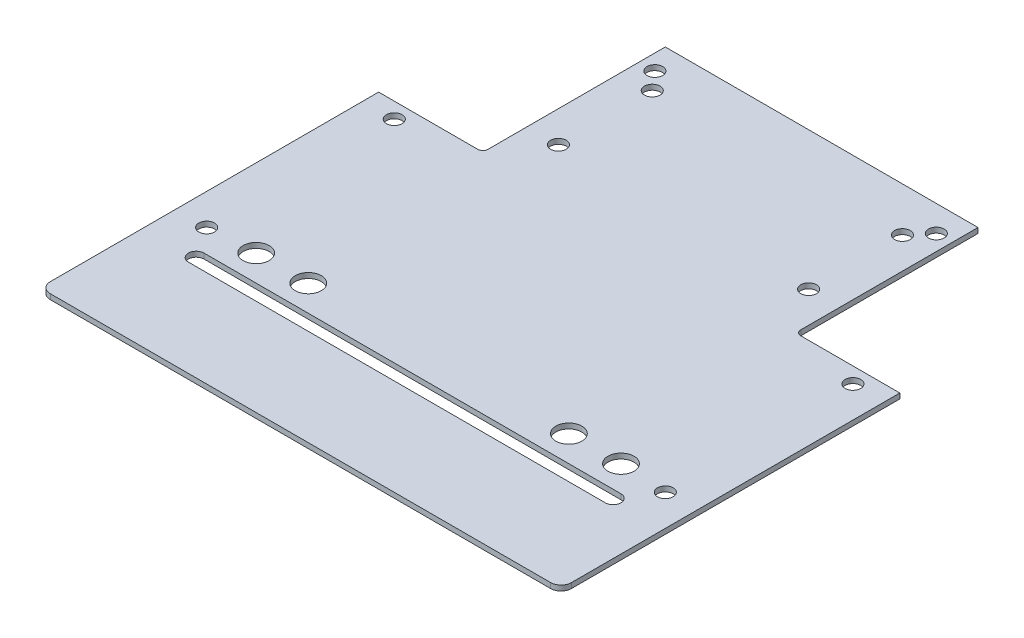
from build123d import *

# Parameters (mm, degrees)
BOSS_EXTRUDE1_DEPTH = 1
SKETCH2_R           = 1.5
SKETCH2_R_2         = 2.5
CUT_EXTRUDE2_DEPTH  = 1
SKETCH3_R           = 1.5
CUT_EXTRUDE3_DEPTH  = 1


with BuildPart() as part:
    # Sketch1 → Boss-Extrude1 (new body)
    with BuildSketch(Plane(origin=(0, 0, 0), x_dir=(1, 0, 0), z_dir=(0, 1, 0))):
        with BuildLine():
            Line((2, 0), (98, 0))
            ThreePointArc((98, 0), (99.414213562, 0.585786438), (100, 2))
            Line((100, 2), (100, 98))
            ThreePointArc((100, 98), (99.414213562, 99.414213562), (98, 100))
            Line((98, 100), (2, 100))
            ThreePointArc((2, 100), (0.585786438, 99.414213562), (0, 98))
            Line((0, 98), (0, 2))
            ThreePointArc((0, 2), (0.585786438, 0.585786438), (2, 0))
        make_face()
        with BuildLine():
            Line((10, 21.5), (90, 21.5))
            ThreePointArc((90, 21.5), (91.5, 20), (90, 18.5))
            Line((90, 18.5), (10, 18.5))
            ThreePointArc((10, 18.5), (8.5, 20), (10, 21.5))
        make_face(mode=Mode.SUBTRACT)
    extrude(amount=BOSS_EXTRUDE1_DEPTH)

    # Sketch2 → Cut-Extrude2 (cut)
    with BuildSketch(Plane(origin=(0, 1, 0), x_dir=(1, 0, 0), z_dir=(0, 1, 0))):
        with BuildLine():
            Line((0, 100), (0, 65))
            Line((0, 65), (19, 65))
            ThreePointArc((19, 65), (19.707106781, 65.292893219), (20, 66))
            Line((20, 66), (20, 100))
            Line((20, 100), (0, 100))
        make_face()
        with BuildLine():
            Line((100, 65), (100, 100))
            Line((100, 100), (80, 100))
            Line((80, 100), (80, 66))
            ThreePointArc((80, 66), (80.292893219, 65.292893219), (81, 65))
            Line((81, 65), (100, 65))
        make_face()
        with Locations(Location((26, 91.5, 0), (0, 0, 270))):
            Circle(SKETCH2_R)
        with Locations(Location((26, 73.5, 0), (0, 0, 90))):
            Circle(SKETCH2_R)
        with Locations(Location((74, 91.5, 0), (0, 0, 270))):
            Circle(SKETCH2_R)
        with Locations(Location((74, 73.5, 0), (0, 0, 270))):
            Circle(SKETCH2_R)
        with Locations(Location((15, 26.5, 0), (0, 0, 270))):
            Circle(SKETCH2_R_2)
        with Locations(Location((25, 26.5, 0), (0, 0, 270))):
            Circle(SKETCH2_R_2)
        with Locations(Location((85, 26.5, 0), (0, 0, 270))):
            Circle(SKETCH2_R_2)
        with Locations(Location((75, 26.5, 0), (0, 0, 90))):
            Circle(SKETCH2_R_2)
    extrude(amount=-CUT_EXTRUDE2_DEPTH, mode=Mode.SUBTRACT)

    # Sketch3 → Cut-Extrude3 (cut)
    with BuildSketch(Plane(origin=(0, 1, 0), x_dir=(1, 0, 0), z_dir=(0, 1, 0))):
        with Locations(Location((6, 26, 0), (0, 0, 270))):
            Circle(SKETCH3_R)
        with Locations(Location((23, 95, 0), (0, 0, 270))):
            Circle(SKETCH3_R)
        with Locations(Location((77, 95, 0), (0, 0, 270))):
            Circle(SKETCH3_R)
        with Locations(Location((94, 26, 0), (0, 0, 270))):
            Circle(SKETCH3_R)
        with Locations(Location((6, 62, 0), (0, 0, 270))):
            Circle(SKETCH3_R)
        with Locations(Location((94, 62, 0), (0, 0, 270))):
            Circle(SKETCH3_R)
    extrude(amount=-CUT_EXTRUDE3_DEPTH, mode=Mode.SUBTRACT)


solid = part.part
